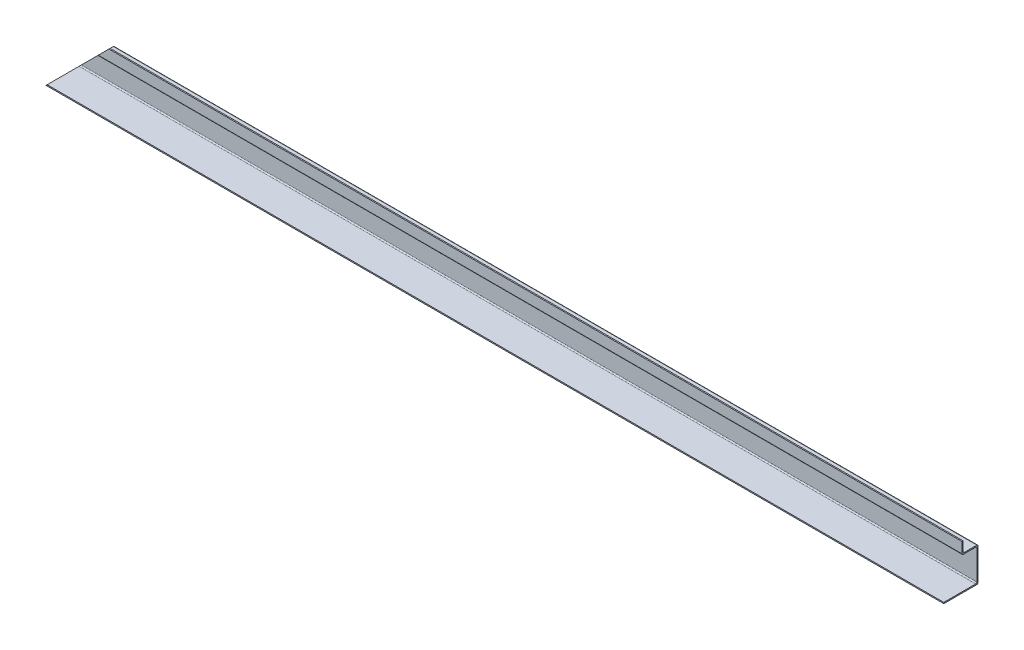
from build123d import *

# Parameters (mm, degrees)
BOSS_EXTRUDE1_DEPTH = 2310
FILLET1_R           = 3
CUT_EXTRUDE1_DEPTH  = 88


with BuildPart() as part:
    # Sketch1 → Boss-Extrude1 (new body)
    with BuildSketch(Plane(origin=(0, 0, 0), x_dir=(0, 0, -1), z_dir=(1, 0, 0))):
        Polygon((0, 0), (85, 0), (85, 82), (47, 82), (47, 112), (50, 112), (50, 85), (88, 85), (88, -3), (0, -3), align=None)
    extrude(amount=BOSS_EXTRUDE1_DEPTH)

    # Fillet1
    fillet1_edges = [part.edges().sort_by_distance(p)[0] for p in [
        (1155, 0, -85),
        (1155, 82, -85),
        (1155, 82, -47),
        (1155, 85, -50),
        (1155, 85, -88),
        (1155, -3, -88),
    ]]
    fillet(fillet1_edges, radius=FILLET1_R)

    # Sketch2 → Cut-Extrude1 (cut)
    with BuildSketch(Plane(origin=(0, 0, -88), x_dir=(-1, 0, 0), z_dir=(0, 0, -1))):
        Polygon((0, -3), (-115, 112), (0, 112), align=None)
    extrude(amount=-CUT_EXTRUDE1_DEPTH, mode=Mode.SUBTRACT)


solid = part.part
